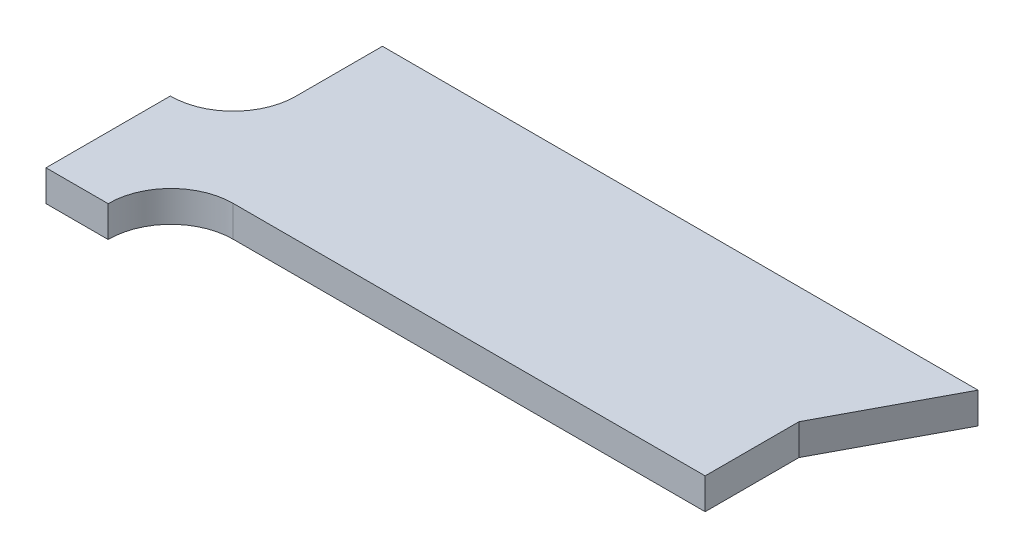
from build123d import *

# Parameters (mm, degrees)
BOSS_EXTRUDE1_DEPTH = 0.25


with BuildPart() as part:
    # Sketch2 → Boss-Extrude1 (new body)
    with BuildSketch(Plane(origin=(0, 0, 0), x_dir=(1, 0, 0), z_dir=(0, 1, 0))):
        with BuildLine():
            Line((0, 0), (0.5, 0))
            ThreePointArc((0.5, 0), (0.644690069, 0.356724455), (0.999975872, 0.504912007))
            Line((0.999975872, 0.504912007), (4.798067741, 0.504912007))
            Line((4.798067741, 0.504912007), (4.798067741, 1.259636767))
            Line((4.798067741, 1.259636767), (5.298067741, 2.2))
            Line((5.298067741, 2.2), (0.506730751, 2.2))
            Line((0.506730751, 2.2), (0.506730751, 1.503359769))
            ThreePointArc((0.506730751, 1.503359769), (0.358106958, 1.146236852), (0, 1))
            Line((0, 1), (0, 0))
        make_face()
    extrude(amount=BOSS_EXTRUDE1_DEPTH)


solid = part.part
